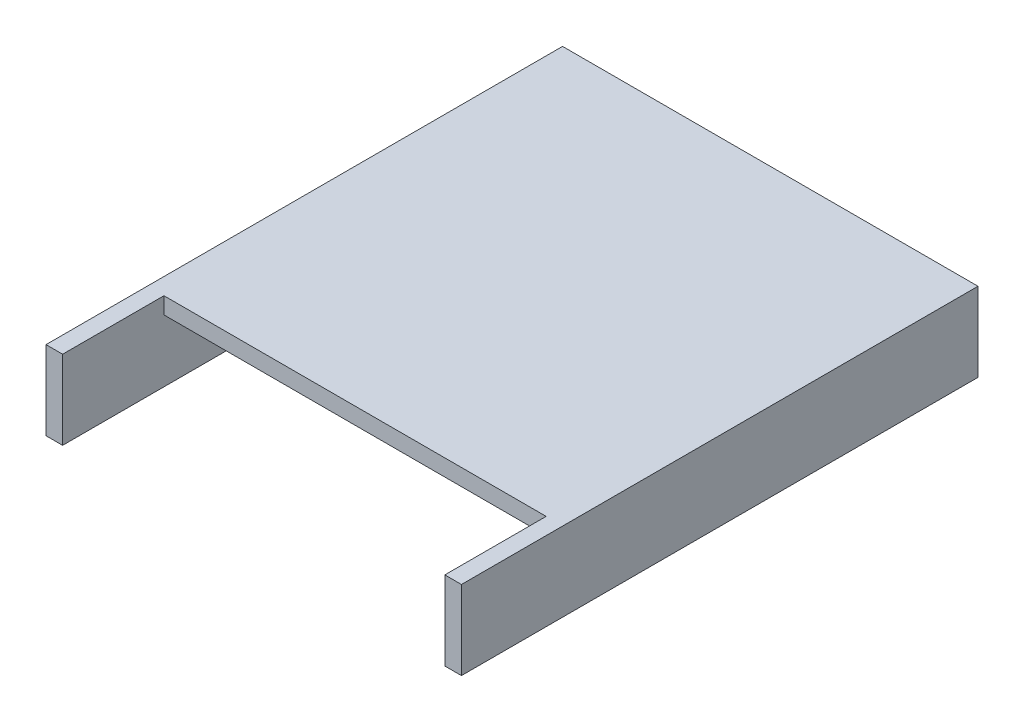
from build123d import *

# Parameters (mm, degrees)
BOSS_EXTRUDE1_DEPTH = 99.95
SKETCH2_W           = 4
SKETCH2_H           = 19
BOSS_EXTRUDE2_DEPTH = 24.39


with BuildPart() as part:
    # Sketch1 → Boss-Extrude1 (new body)
    with BuildSketch(Plane.XY):
        Polygon((52.648648649, 19.666666667), (56.648648649, 19.666666667), (56.648648649, 38.666666667), (-43.351351351, 38.666666667), (-43.351351351, 19.666666667), (-39.351351351, 19.666666667), (-39.351351351, 34.666666667), (52.648648649, 34.666666667), align=None)
    extrude(amount=BOSS_EXTRUDE1_DEPTH)

    # Sketch2 → Boss-Extrude2 (add)
    with BuildSketch(Plane.XY.offset(99.95)):
        with Locations((-41.351351351, 29.166666667)):
            Rectangle(SKETCH2_W, SKETCH2_H)
        with Locations((54.648648649, 29.166666667)):
            Rectangle(SKETCH2_W, SKETCH2_H)
    extrude(amount=BOSS_EXTRUDE2_DEPTH)


solid = part.part
